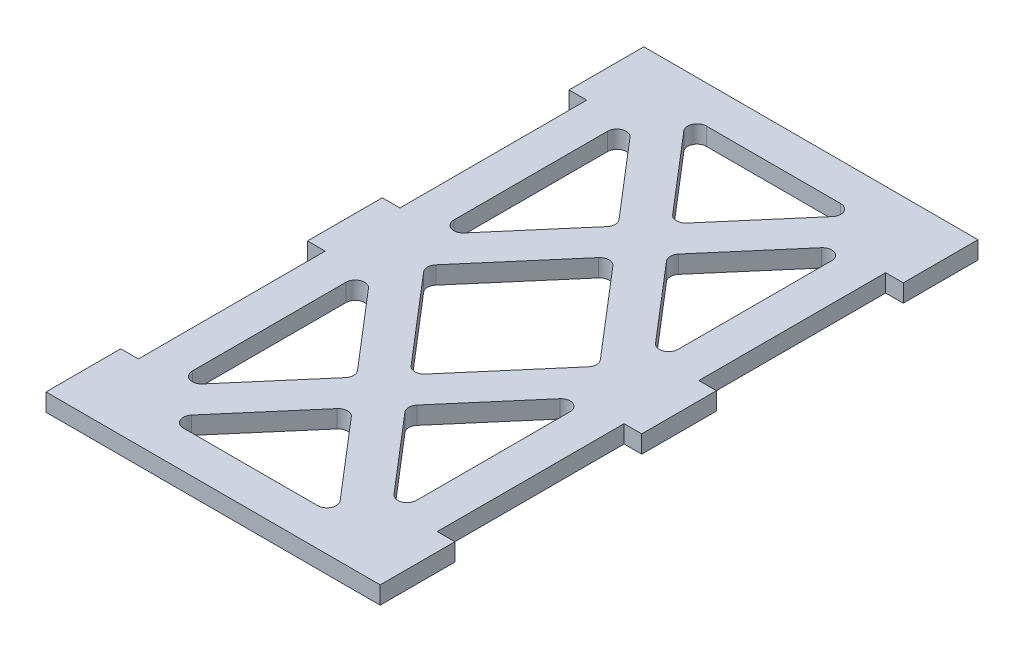
from build123d import *

# Parameters (mm, degrees)
SKETCH1_W           = 50.8
SKETCH1_H           = 101.6
BOSS_EXTRUDE1_DEPTH = 2.9972
SKETCH2_W           = 2.9972
SKETCH2_H           = 12.7
BOSS_EXTRUDE2_DEPTH = 2.9972
SKETCH3_W           = 38.1
SKETCH3_H           = 88.9
CUT_EXTRUDE1_DEPTH  = 59.275416564
EXTRUDE_THIN1_DEPTH = 2.9972
FILLET1_R           = 1.5875


with BuildPart() as part:
    # Sketch1 → Boss-Extrude1 (new body)
    with BuildSketch(Plane(origin=(0, 0, 0), x_dir=(1, 0, 0), z_dir=(0, 1, 0))):
        Rectangle(SKETCH1_W, SKETCH1_H)
    extrude(amount=BOSS_EXTRUDE1_DEPTH)

    # Sketch2 → Boss-Extrude2 (add)
    with BuildSketch(Plane(origin=(0, 2.9972, 0), x_dir=(1, 0, 0), z_dir=(0, 1, 0))):
        with Locations((26.8986, 0)):
            Rectangle(SKETCH2_W, SKETCH2_H)
        with Locations((26.8986, 44.45)):
            Rectangle(SKETCH2_W, SKETCH2_H)
        with Locations((26.8986, -44.45)):
            Rectangle(SKETCH2_W, SKETCH2_H)
        with Locations((-26.8986, 0)):
            Rectangle(SKETCH2_W, SKETCH2_H)
        with Locations((-26.8986, -44.45)):
            Rectangle(SKETCH2_W, SKETCH2_H)
        with Locations((-26.8986, 44.45)):
            Rectangle(SKETCH2_W, SKETCH2_H)
    extrude(amount=-BOSS_EXTRUDE2_DEPTH)

    # Sketch3 → Cut-Extrude1 (cut, through all)
    with BuildSketch(Plane(origin=(0, 2.9972, 0), x_dir=(1, 0, 0), z_dir=(0, 1, 0))):
        Rectangle(SKETCH3_W, SKETCH3_H)
    extrude(amount=-CUT_EXTRUDE1_DEPTH, mode=Mode.SUBTRACT)

    # Sketch4 → Extrude-Thin1 (add)
    with BuildSketch(Plane(origin=(0, 2.9972, 0), x_dir=(1, 0, 0), z_dir=(0, 1, 0))):
        Polygon((-16.639360287, -46.516262611), (23.23172195, 0), (-16.639360287, 46.516262611), (-21.460639713, 42.383737389), (14.86827805, 0), (-21.460639713, -42.383737389), align=None)
        Polygon((16.639360287, 46.516262611), (-23.23172195, 0), (16.639360287, -46.516262611), (21.460639713, -42.383737389), (-14.86827805, 0), (21.460639713, 42.383737389), align=None)
    extrude(amount=-EXTRUDE_THIN1_DEPTH)

    # Fillet1
    fillet1_edges = [part.edges().sort_by_distance(p)[0] for p in [
        (14.86827805, 1.4986, 44.45),
        (-14.86827805, 1.4986, 44.45),
        (19.05, 1.4986, -39.571324391),
        (19.05, 1.4986, 39.571324391),
        (19.05, 1.4986, 4.878675609),
        (19.05, 1.4986, -4.878675609),
        (14.86827805, 1.4986, -44.45),
        (-14.86827805, 1.4986, -44.45),
        (-19.05, 1.4986, 4.878675609),
        (-19.05, 1.4986, -4.878675609),
        (-19.05, 1.4986, -39.571324391),
        (-19.05, 1.4986, 39.571324391),
        (-4.18172195, 1.4986, 22.225),
        (-4.18172195, 1.4986, -22.225),
        (0, 1.4986, -27.103675609),
        (4.18172195, 1.4986, -22.225),
        (4.18172195, 1.4986, 22.225),
        (0, 1.4986, 27.103675609),
        (14.86827805, 1.4986, 0),
        (0, 1.4986, -17.346324391),
        (0, 1.4986, 17.346324391),
        (-14.86827805, 1.4986, 0),
    ]]
    fillet(fillet1_edges, radius=FILLET1_R)


solid = part.part
